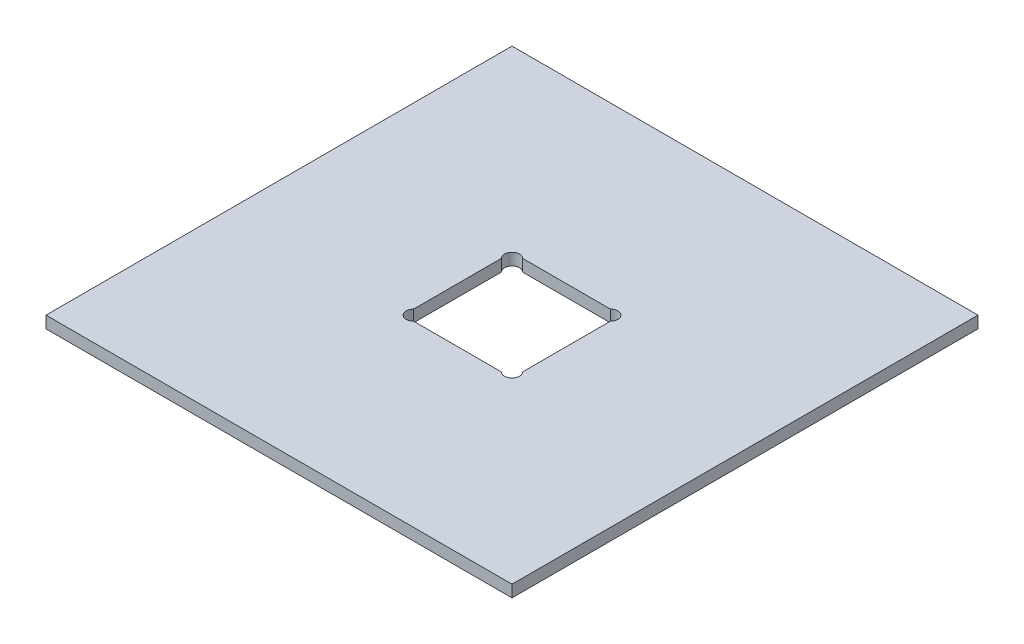
from build123d import *

# Parameters (mm, degrees)
SKETCH_1_W          = 62.64117319
SKETCH_1_H          = 62.64117319
EXTRUDE_1_DEPTH     = 1.6
CUT_EXTRUDE_1_DEPTH = 1.6


with BuildPart() as part:
    # 草图1 → 凸台-拉伸1 (new body)
    with BuildSketch(Plane(origin=(0, 0, 0), x_dir=(1, 0, 0), z_dir=(0, 1, 0))):
        Rectangle(SKETCH_1_W, SKETCH_1_H)
    extrude(amount=EXTRUDE_1_DEPTH)

    # 草图2 → 切除-拉伸1 (cut)
    with BuildSketch(Plane(origin=(0, 1.6, 0), x_dir=(1, 0, 0), z_dir=(0, 1, 0))):
        with BuildLine():
            Line((-5.906373033, 7.320586595), (5.906373033, 7.320586595))
            ThreePointArc((5.906373033, 7.320586595), (7.320586595, 7.320586595), (7.320586595, 5.906373033))
            Line((7.320586595, 5.906373033), (7.320586595, -5.906373033))
            ThreePointArc((7.320586595, -5.906373033), (7.320586595, -7.320586595), (5.906373033, -7.320586595))
            Line((5.906373033, -7.320586595), (-5.906373033, -7.320586595))
            ThreePointArc((-5.906373033, -7.320586595), (-7.320586595, -7.320586595), (-7.320586595, -5.906373033))
            Line((-7.320586595, -5.906373033), (-7.320586595, 5.906373033))
            ThreePointArc((-7.320586595, 5.906373033), (-7.320586595, 7.320586595), (-5.906373033, 7.320586595))
        make_face()
    extrude(amount=-CUT_EXTRUDE_1_DEPTH, mode=Mode.SUBTRACT)


solid = part.part
